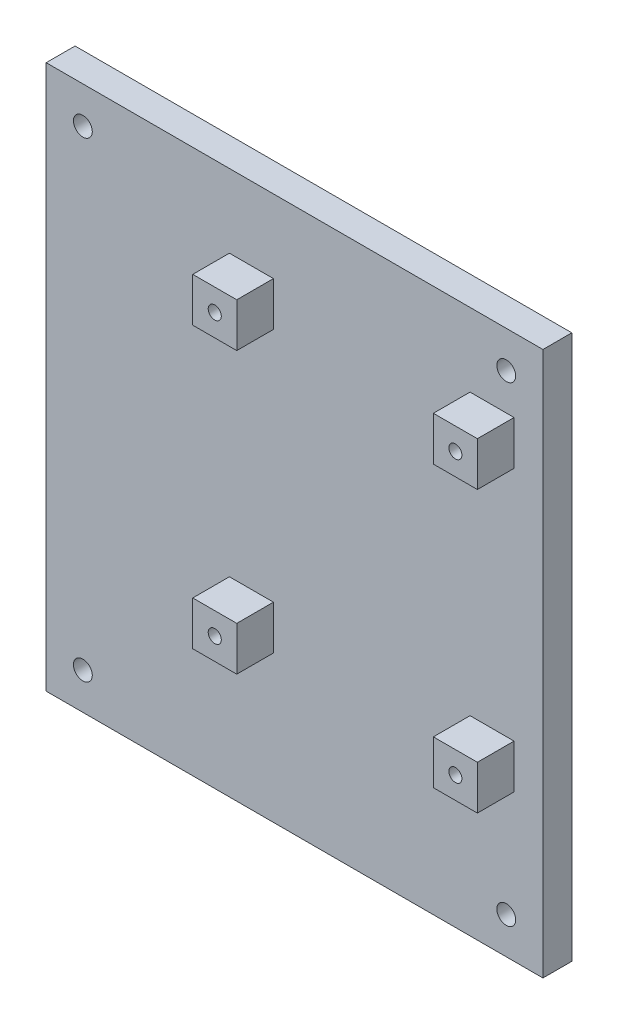
from build123d import *

# Parameters (mm, degrees)
SKETCH1_W                 = 85.999999704
SKETCH1_H                 = 94.234
BOSS_EXTRUDE1_DEPTH       = 4.999999906
SKETCH2_W                 = 7.62
SKETCH2_H                 = 7.62
BOSS_EXTRUDE2_DEPTH       = 6.35
F_4_40_TAPPED_HOLE1_D     = 2.2606
F_4_40_TAPPED_HOLE1_DEPTH = 4.7498
F_4_40_TAPPED_HOLE1_TIP   = 0.679152758
F_4_CLEARANCE_HOLE1_D     = 3.2639


with BuildPart() as part:
    # Sketch1 → Boss-Extrude1 (new body)
    with BuildSketch(Plane.XY):
        Rectangle(SKETCH1_W, SKETCH1_H)
    extrude(amount=BOSS_EXTRUDE1_DEPTH)

    # Sketch2 → Boss-Extrude2 (add)
    with BuildSketch(Plane.XY.offset(4.999999906)):
        with Locations((-7.466000054, 30.607)):
            Rectangle(SKETCH2_W, SKETCH2_H)
        with Locations((34.189999946, 30.607)):
            Rectangle(SKETCH2_W, SKETCH2_H)
        with Locations((-7.466000054, -17.907)):
            Rectangle(SKETCH2_W, SKETCH2_H)
        with Locations((34.189999946, -17.907)):
            Rectangle(SKETCH2_W, SKETCH2_H)
    extrude(amount=BOSS_EXTRUDE2_DEPTH)

    # #4-40 Tapped Hole1
    with Locations(Plane.XY.offset(11.349999906)):
        with Locations((-7.466000054, 30.607), (34.189999946, 30.607), (-7.466000054, -17.907), (34.189999946, -17.907)):
            Hole(F_4_40_TAPPED_HOLE1_D / 2, depth=F_4_40_TAPPED_HOLE1_DEPTH)
            with Locations((0, 0, -(F_4_40_TAPPED_HOLE1_DEPTH + F_4_40_TAPPED_HOLE1_TIP / 2))):  # 118° drill point
                Cone(0, F_4_40_TAPPED_HOLE1_D / 2, F_4_40_TAPPED_HOLE1_TIP, mode=Mode.SUBTRACT)

    # #4 Clearance Hole1 (through all)
    with Locations(Plane.XY.offset(4.999999906)):
        with Locations((-36.649999852, 40.767), (36.649999852, 40.767), (-36.649999852, -40.767), (36.649999852, -40.767)):
            Hole(F_4_CLEARANCE_HOLE1_D / 2)


solid = part.part
